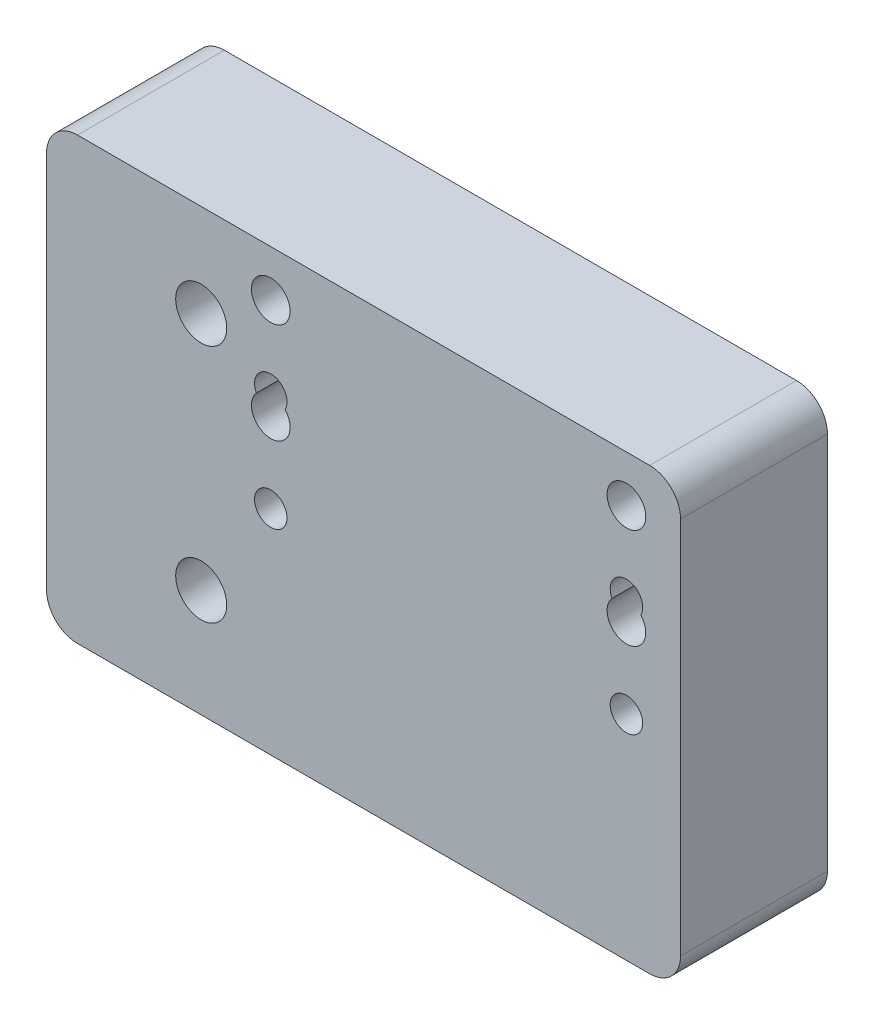
from build123d import *

# Parameters (mm, degrees)
SKETCH1_W                                           = 81.999999998
SKETCH1_H                                           = 60
BOSS_EXTRUDE1_DEPTH                                 = 19
TAP_DRILL_FOR_M6_TAP1_D                             = 5
CSK_FOR_M6_COUNTERSUNK_FLAT_HEAD_SCREW1_D           = 6.6
CSK_FOR_M6_COUNTERSUNK_FLAT_HEAD_SCREW1_CSINK_D     = 12.6
CSK_FOR_M6_COUNTERSUNK_FLAT_HEAD_SCREW1_CSINK_ANGLE = 90
SKETCH7_W                                           = 81.999999998
SKETCH7_H                                           = 4
CUT_EXTRUDE1_DEPTH                                  = 95.50348792
SKETCH10_W                                          = 81.999999998
SKETCH10_H                                          = 0.95
BOSS_EXTRUDE2_DEPTH                                 = 19
FILLET1_R                                           = 4
TAP_DRILL_FOR_M5_TAP1_D                             = 4.2
TAP_DRILL_FOR_M5_TAP1_DEPTH                         = 30
TAP_DRILL_FOR_M5_TAP1_TIP                           = 1.2618073
TAP_DRILL_FOR_M5_TAP2_D                             = 4.2


with BuildPart() as part:
    # Sketch1 → Boss-Extrude1 (new body)
    with BuildSketch(Plane.XY):
        with Locations((20.999999999, 38.745248777)):
            Rectangle(SKETCH1_W, SKETCH1_H)
    extrude(amount=BOSS_EXTRUDE1_DEPTH)

    # Tap Drill for M6 Tap1 (through all)
    with Locations(Plane.XY.offset(19)):
        with Locations((8.999999998, 58.745248777), (54.999999998, 58.745248777), (54.999999998, 45.745248777), (8.999999998, 45.745248777)):
            Hole(TAP_DRILL_FOR_M6_TAP1_D / 2)

    # CSK for M6 Countersunk Flat Head Screw1 (through all)
    with Locations(Plane(origin=(0, 0, 0), x_dir=(1, 0, 0), z_dir=(0, 0, -1))):
        with Locations((0, -21.745248777), (0, -52.745248777)):
            CounterSinkHole(CSK_FOR_M6_COUNTERSUNK_FLAT_HEAD_SCREW1_D / 2, CSK_FOR_M6_COUNTERSUNK_FLAT_HEAD_SCREW1_CSINK_D / 2, counter_sink_angle=CSK_FOR_M6_COUNTERSUNK_FLAT_HEAD_SCREW1_CSINK_ANGLE)

    # Sketch7 → Cut-Extrude1 (cut, through all)
    with BuildSketch(Plane(origin=(0, 0, 0), x_dir=(-1, 0, 0), z_dir=(0, 0, -1))):
        with Locations((-20.999999999, 66.745248777)):
            Rectangle(SKETCH7_W, SKETCH7_H)
    extrude(amount=-CUT_EXTRUDE1_DEPTH, mode=Mode.SUBTRACT)

    # Sketch10 → Boss-Extrude2 (add)
    with BuildSketch(Plane(origin=(0, 0, 0), x_dir=(-1, 0, 0), z_dir=(0, 0, -1))):
        with Locations((-20.999999999, 8.270248777)):
            Rectangle(SKETCH10_W, SKETCH10_H)
    extrude(amount=-BOSS_EXTRUDE2_DEPTH)

    # Fillet1
    fillet1_edges = [part.edges().sort_by_distance(p)[0] for p in [
        (-20, 64.745248777, 9.5),
        (61.999999998, 64.745248777, 9.5),
        (61.999999998, 7.795248777, 9.5),
        (-20, 7.795248777, 9.5),
    ]]
    fillet(fillet1_edges, radius=FILLET1_R)

    # Tap Drill for M5 Tap1
    with Locations(Plane(origin=(0, 7.795248777, 0), x_dir=(-1, 0, 0), z_dir=(0, -1, 0))):
        with Locations((-41.999999998, -9.499999998)):
            Hole(TAP_DRILL_FOR_M5_TAP1_D / 2, depth=TAP_DRILL_FOR_M5_TAP1_DEPTH)
            with Locations((0, 0, -(TAP_DRILL_FOR_M5_TAP1_DEPTH + TAP_DRILL_FOR_M5_TAP1_TIP / 2))):  # 118° drill point
                Cone(0, TAP_DRILL_FOR_M5_TAP1_D / 2, TAP_DRILL_FOR_M5_TAP1_TIP, mode=Mode.SUBTRACT)

    # Tap Drill for M5 Tap2 (through all)
    with Locations(Plane.XY.offset(19)):
        with Locations((54.999999998, 35.395248777), (54.999999998, 48.395248777), (8.999999998, 35.395248777), (8.999999998, 48.395248777)):
            Hole(TAP_DRILL_FOR_M5_TAP2_D / 2)


solid = part.part
